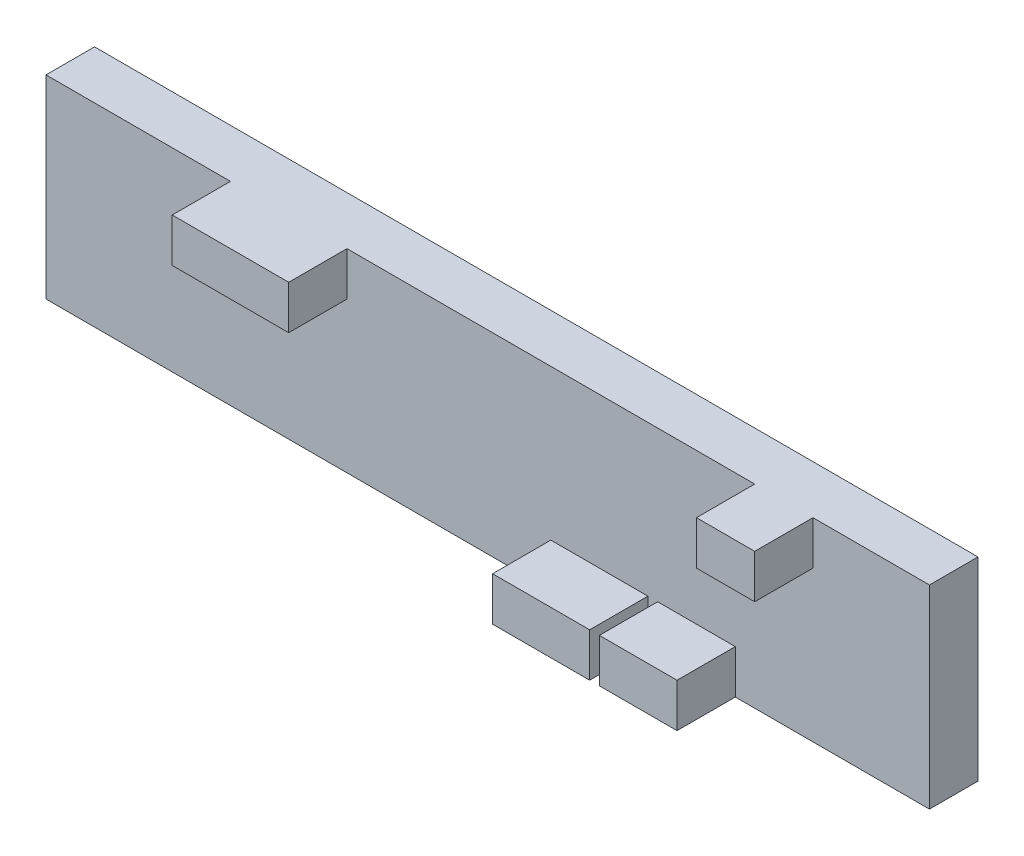
from build123d import *

# Parameters (mm, degrees)
SKETCH_1_W      = 91
SKETCH_1_H      = 20
EXTRUDE_1_DEPTH = 5
SKETCH_2_W      = 12
SKETCH_2_H      = 4.5
SKETCH_2_W_2    = 6
SKETCH_2_W_3    = 10
SKETCH_2_W_4    = 8
EXTRUDE_2_DEPTH = 6


with BuildPart() as part:
    # Эскиз1 → Бобышка-Вытянуть1 (new body)
    with BuildSketch(Plane.XY):
        with Locations((45.5, 10)):
            Rectangle(SKETCH_1_W, SKETCH_1_H)
    extrude(amount=EXTRUDE_1_DEPTH)

    # Эскиз2 → Бобышка-Вытянуть2 (add)
    with BuildSketch(Plane.XY.offset(5)):
        with Locations((25, 17.75)):
            Rectangle(SKETCH_2_W, SKETCH_2_H)
        with Locations((76, 17.75)):
            Rectangle(SKETCH_2_W_2, SKETCH_2_H)
        with Locations((57, 2.25)):
            Rectangle(SKETCH_2_W_3, SKETCH_2_H)
        with Locations((67, 2.25)):
            Rectangle(SKETCH_2_W_4, SKETCH_2_H)
    extrude(amount=EXTRUDE_2_DEPTH)


solid = part.part
